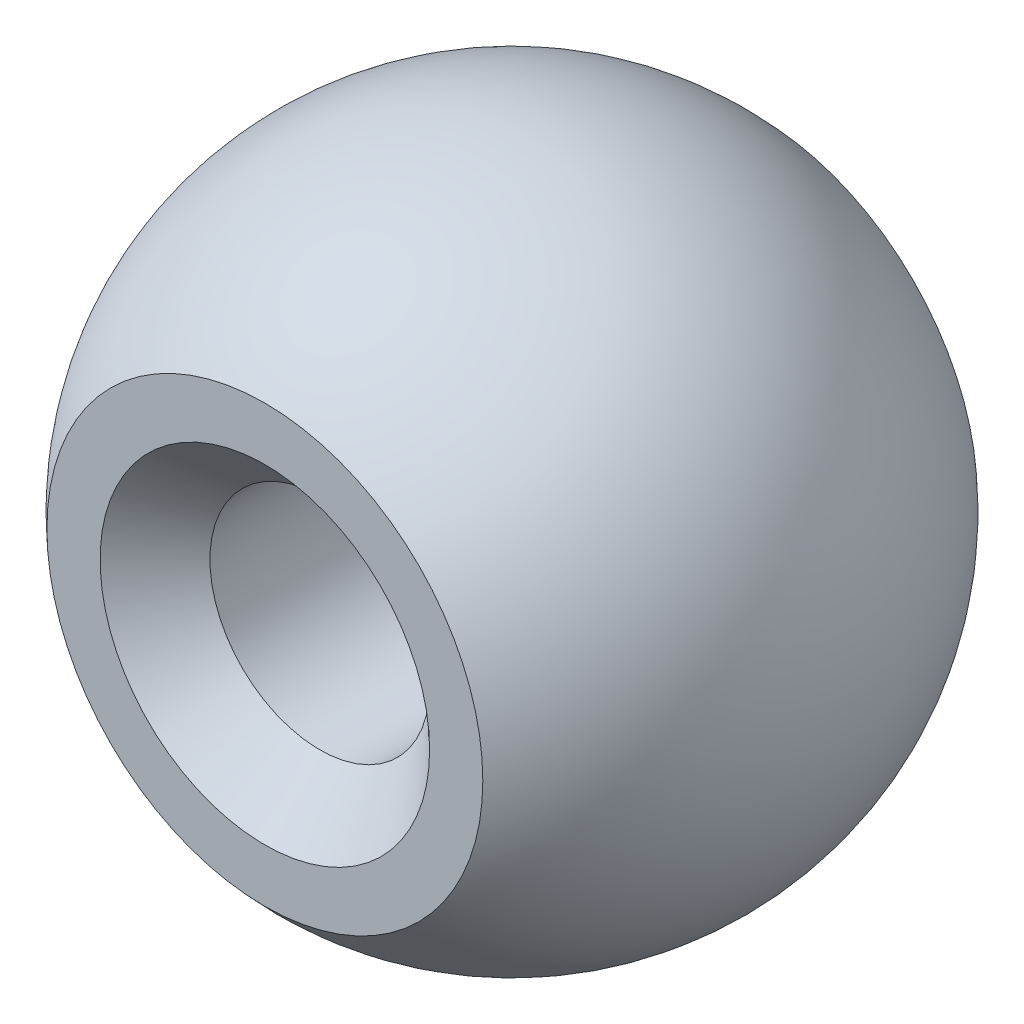
from build123d import *

# Parameters (mm, degrees)
CSK_FOR_M2_CROSS_COUNTERSUNK_HEAD_SCREW1_D           = 4
CSK_FOR_M2_CROSS_COUNTERSUNK_HEAD_SCREW1_CSINK_D     = 6
CSK_FOR_M2_CROSS_COUNTERSUNK_HEAD_SCREW1_CSINK_ANGLE = 90


with BuildPart() as part:
    # Sketch1 → Revolve1 (revolve)
    with BuildSketch(Plane(origin=(0, 0, 0), x_dir=(1, 0, 0), z_dir=(0, 1, 0))):
        with BuildLine():
            Line((0, 4.5), (3.968626967, 4.5))
            ThreePointArc((3.968626967, 4.5), (6, 0), (3.968626967, -4.5))
            Line((3.968626967, -4.5), (0, -4.5))
            Line((0, -4.5), (0, 4.5))
        make_face()
    revolve(axis=Axis((0, 0, 4.5), (0, 0, -1)))

    # CSK for M2 Cross Countersunk Head Screw1 (through all)
    with Locations(Plane.XY.offset(4.5)):
        with Locations((0, 0)):
            CounterSinkHole(CSK_FOR_M2_CROSS_COUNTERSUNK_HEAD_SCREW1_D / 2, CSK_FOR_M2_CROSS_COUNTERSUNK_HEAD_SCREW1_CSINK_D / 2, counter_sink_angle=CSK_FOR_M2_CROSS_COUNTERSUNK_HEAD_SCREW1_CSINK_ANGLE)


solid = part.part
